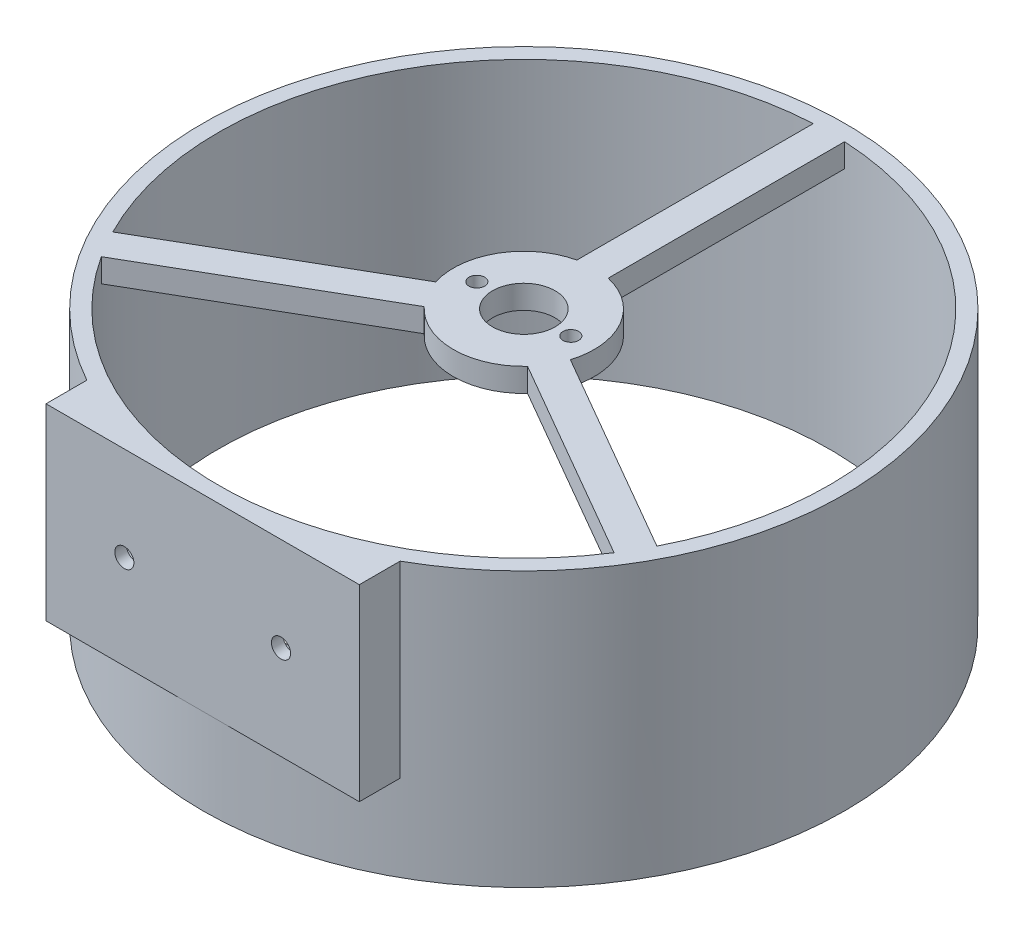
from build123d import *

# Parameters (mm, degrees)
SKETCH_1_R           = 41
SKETCH_1_R_2         = 39
EXTRUDE_1_DEPTH      = 20
EXTRUDE_START        = -14
EXTRUDE_2_DEPTH      = 14
EXTRUDE_START_2      = -3
SKETCH_3_R           = 4
SKETCH_3_R_2         = 1
EXTRUDE_3_DEPTH      = 3
CUT_EXTRUDE_3_DEPTH  = 3
EXTRUDE_5_DEPTH      = 10
EXTRUDE_5_DEPTH_BACK = 15
SKETCH_1_2_R         = 41
SKETCH_1_2_R_2       = 39
EXTRUDE_START_3      = 10
EXTRUDE_7_DEPTH      = 10
EXTRUDE_8_DEPTH      = 10
EXTRUDE_8_DEPTH_BACK = 5
CUT_EXTRUDE_4_DEPTH  = 10
EXTRUDE_9_DEPTH      = 10
EXTRUDE_9_DEPTH_BACK = 1.5
CUT_EXTRUDE_6_DEPTH  = 10
SKETCH_16_R          = 1.22
CUT_EXTRUDE_7_DEPTH  = 3


with BuildPart() as part:
    # 草图1 → 凸台-拉伸1 (new body)
    with BuildSketch(Plane(origin=(0, 0, 0), x_dir=(1, 0, 0), z_dir=(0, 1, 0))):
        Circle(SKETCH_1_R)
        Circle(SKETCH_1_R_2, mode=Mode.SUBTRACT)
    extrude(amount=EXTRUDE_1_DEPTH)

    # 草图2 → 凸台-拉伸2 (add)
    with BuildSketch(Plane(origin=(0, 20, 0), x_dir=(1, 0, 0), z_dir=(0, 1, 0)).offset(EXTRUDE_START)):
        with BuildLine():
            Line((3.5e-08, -41), (20, -41))
            Line((20, -41), (20, -35.791060336))
            ThreePointArc((20, -35.791060336), (10.333598766, -39.676400247), (3.5e-08, -41))
        make_face()
        with BuildLine():
            Line((-20, -41), (3.5e-08, -41))
            ThreePointArc((3.5e-08, -41), (-10.333598732, -39.676400256), (-20, -35.791060336))
            Line((-20, -35.791060336), (-20, -41))
        make_face()
    extrude(amount=EXTRUDE_2_DEPTH)

    # 草图3 → 凸台-拉伸3 (add)
    with BuildSketch(Plane(origin=(0, 20, 0), x_dir=(1, 0, 0), z_dir=(0, 1, 0)).offset(EXTRUDE_START_2)):
        with BuildLine():
            Line((-2, 38.948684188), (-2, 8.774964387))
            ThreePointArc((-2, 8.774964387), (-7.794228634, 4.5), (-8.599342077, -2.655431386))
            Line((-8.599342077, -2.655431386), (-34.730549951, -17.742291287))
            ThreePointArc((-34.730549951, -17.742291287), (-33.774990748, -19.5), (-32.730549951, -21.206392902))
            Line((-32.730549951, -21.206392902), (-6.599342077, -6.119533001))
            ThreePointArc((-6.599342077, -6.119533001), (0, -9), (6.599342077, -6.119533001))
            Line((6.599342077, -6.119533001), (32.730549951, -21.206392902))
            ThreePointArc((32.730549951, -21.206392902), (33.774990748, -19.5), (34.730549951, -17.742291287))
            Line((34.730549951, -17.742291287), (8.599342077, -2.655431386))
            ThreePointArc((8.599342077, -2.655431386), (7.794228634, 4.5), (2, 8.774964387))
            Line((2, 8.774964387), (2, 38.948684188))
            ThreePointArc((2, 38.948684188), (0, 39), (-2, 38.948684188))
        make_face()
        Circle(SKETCH_3_R, mode=Mode.SUBTRACT)
        with Locations((-6, 0)):
            Circle(SKETCH_3_R_2, mode=Mode.SUBTRACT)
        with Locations((6, 0)):
            Circle(SKETCH_3_R_2, mode=Mode.SUBTRACT)
    extrude(amount=EXTRUDE_3_DEPTH)

    # 草图7 → 切除-拉伸3 (cut)
    with BuildSketch(Plane.XZ.offset(-6)):
        with BuildLine():
            Line((0, 41), (-20, 41))
            Line((-20, 41), (-20, 35.791060336))
            ThreePointArc((-20, 35.791060336), (-10.333598749, 39.676400251), (0, 41))
        make_face()
        with BuildLine():
            Line((20, 41), (0, 41))
            ThreePointArc((0, 41), (10.333598749, 39.676400251), (20, 35.791060336))
            Line((20, 35.791060336), (20, 41))
        make_face()
    extrude(amount=-CUT_EXTRUDE_3_DEPTH, mode=Mode.SUBTRACT)

    # 草图1<2> → 凸台-拉伸5 (add, two sides: drawn at the far end of the back side and taken through both)
    with BuildSketch(Plane(origin=(0, 0, 0), x_dir=(1, 0, 0), z_dir=(0, 1, 0)).offset(-EXTRUDE_5_DEPTH_BACK)):
        Circle(SKETCH_1_2_R)
        Circle(SKETCH_1_2_R_2, mode=Mode.SUBTRACT)
    extrude(amount=EXTRUDE_5_DEPTH + EXTRUDE_5_DEPTH_BACK)

    # 草图7<4> → 凸台-拉伸7 (add)
    with BuildSketch(Plane.XZ.offset(-6).offset(EXTRUDE_START_3)):
        with BuildLine():
            Line((0, 41), (-20, 41))
            Line((-20, 41), (-20, 35.791060336))
            ThreePointArc((-20, 35.791060336), (-10.333598749, 39.676400251), (0, 41))
        make_face()
        with BuildLine():
            Line((20, 41), (0, 41))
            ThreePointArc((0, 41), (10.333598749, 39.676400251), (20, 35.791060336))
            Line((20, 35.791060336), (20, 41))
        make_face()
    extrude(amount=-EXTRUDE_7_DEPTH)

    # 草图7<5> → 凸台-拉伸8 (add, two sides: drawn at the far end of the back side and taken through both)
    with BuildSketch(Plane.XZ.offset(-6).offset(-EXTRUDE_8_DEPTH_BACK)):
        with BuildLine():
            Line((0, 41), (-20, 41))
            Line((-20, 41), (-20, 35.791060336))
            ThreePointArc((-20, 35.791060336), (-10.333598749, 39.676400251), (0, 41))
        make_face()
        with BuildLine():
            Line((20, 41), (0, 41))
            ThreePointArc((0, 41), (10.333598749, 39.676400251), (20, 35.791060336))
            Line((20, 35.791060336), (20, 41))
        make_face()
    extrude(amount=EXTRUDE_8_DEPTH + EXTRUDE_8_DEPTH_BACK)

    # 草图4 → 切除-拉伸4 (cut)
    with BuildSketch(Plane.XY.offset(41)):
        Polygon((-10, 4.766838493), (-7.2, 6.383419246), (-7.2, 9.616580754), (-10, 11.233161507), (-12.8, 9.616580754), (-12.8, 6.383419246), align=None)
        Polygon((12.8, 6.383419246), (10, 4.766838493), (7.2, 6.383419246), (7.2, 9.616580754), (10, 11.233161507), (12.8, 9.616580754), align=None)
    extrude(amount=-CUT_EXTRUDE_4_DEPTH, mode=Mode.SUBTRACT)

    # 草图4<3> → 凸台-拉伸9 (add, two sides: drawn at the far end of the back side and taken through both)
    with BuildSketch(Plane.XY.offset(41).offset(-EXTRUDE_9_DEPTH_BACK)):
        Polygon((-10, 4.766838493), (-7.2, 6.383419246), (-7.2, 9.616580754), (-10, 11.233161507), (-12.8, 9.616580754), (-12.8, 6.383419246), align=None)
        Polygon((12.8, 6.383419246), (10, 4.766838493), (7.2, 6.383419246), (7.2, 9.616580754), (10, 11.233161507), (12.8, 9.616580754), align=None)
    extrude(amount=EXTRUDE_9_DEPTH + EXTRUDE_9_DEPTH_BACK)

    # 草图13 → 切除-拉伸6 (cut)
    with BuildSketch(Plane.XY.offset(51)):
        Polygon((10, 11.233161507), (7.2, 9.616580754), (7.2, 6.383419246), (10, 4.766838493), (12.8, 6.383419246), (12.8, 9.616580754), align=None)
        Polygon((-10, 11.233161507), (-12.8, 9.616580754), (-12.8, 6.383419246), (-10, 4.766838493), (-7.2, 6.383419246), (-7.2, 9.616580754), align=None)
    extrude(amount=-CUT_EXTRUDE_6_DEPTH, mode=Mode.SUBTRACT)

    # 草图16 → 切除-拉伸7 (cut)
    with BuildSketch(Plane.XY.offset(41)):
        with Locations((-10, 8)):
            Circle(SKETCH_16_R)
        with Locations((10, 8)):
            Circle(SKETCH_16_R)
    extrude(amount=-CUT_EXTRUDE_7_DEPTH, mode=Mode.SUBTRACT)


solid = part.part
